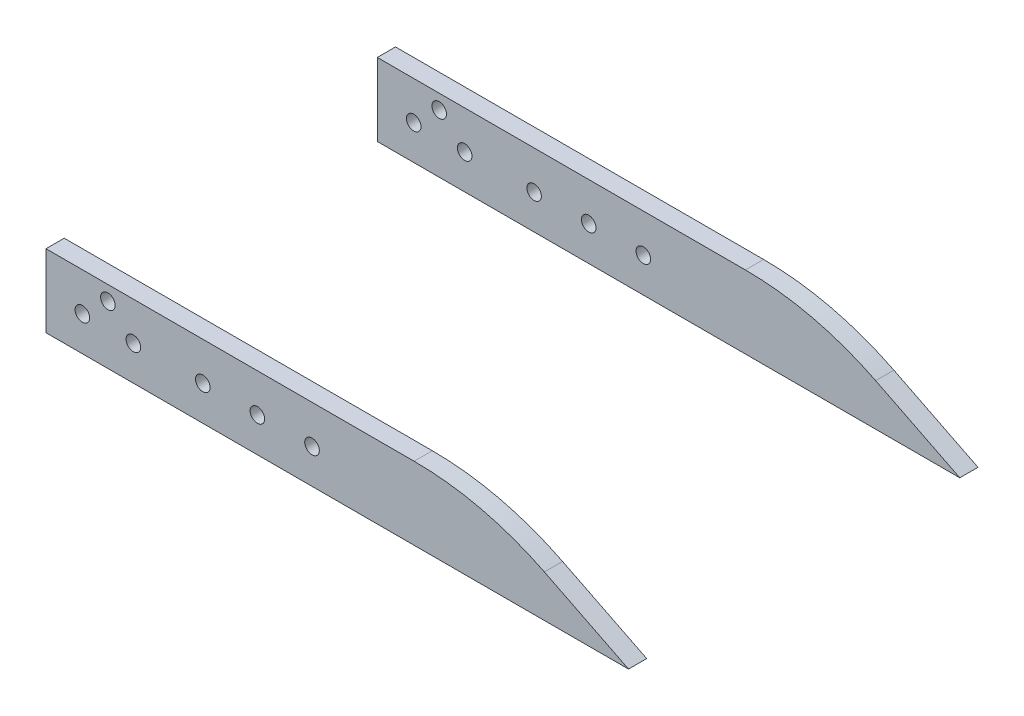
from build123d import *

# Parameters (mm, degrees)
BOSS_EXTRUDE1_START     = 91
BOSS_EXTRUDE1_DEPTH     = 5
BOSS_EXTRUDE2_DEPTH     = 5
CUT_EXTRUDE1_DEPTH      = 186.151289491
CUT_EXTRUDE1_DEPTH_BACK = 186.151289491
SKETCH3_R               = 2


with BuildPart() as part:
    # Sketch2 → Boss-Extrude1 (new body)
    with BuildSketch(Plane.XY.offset(BOSS_EXTRUDE1_START)):
        with BuildLine():
            Line((0, 0), (0, -20))
            Line((0, -20), (160, -20))
            Line((160, -20), (136.89164944, -8.44582472))
            ThreePointArc((136.89164944, -8.44582472), (119.494795444, -2.140080843), (101.1145618, 0))
            Line((101.1145618, 0), (0, 0))
        make_face()
    extrude(amount=BOSS_EXTRUDE1_DEPTH)


with BuildPart() as body_2:
    # Sketch2<2> → Boss-Extrude2 (new body)
    with BuildSketch(Plane.XY):
        with BuildLine():
            Line((0, 0), (0, -20))
            Line((0, -20), (160, -20))
            Line((160, -20), (136.89164944, -8.44582472))
            ThreePointArc((136.89164944, -8.44582472), (119.494795444, -2.140080843), (101.1145618, 0))
            Line((101.1145618, 0), (0, 0))
        make_face()
    extrude(amount=BOSS_EXTRUDE2_DEPTH)


with BuildPart() as cut_extrude1_tool:
    # Sketch3 → Cut-Extrude1 (new, two sides: drawn at the far end of the back side and taken through both)
    with BuildSketch(Plane.XY.offset(5).offset(-CUT_EXTRUDE1_DEPTH_BACK)):
        with Locations((10, -10.5)):
            Circle(SKETCH3_R)
        with Locations((17, -4)):
            Circle(SKETCH3_R)
        with Locations((24, -10.5)):
            Circle(SKETCH3_R)
        with Locations((43.06859969, -10.5)):
            Circle(SKETCH3_R)
        with Locations((58.06859969, -10.5)):
            Circle(SKETCH3_R)
        with Locations((73.06859969, -10.5)):
            Circle(SKETCH3_R)
    extrude(amount=CUT_EXTRUDE1_DEPTH + CUT_EXTRUDE1_DEPTH_BACK)


with BuildPart() as part_1:
    add(part.part)

    # Cut-Extrude1: cut by cut_extrude1_tool
    add(cut_extrude1_tool.part, mode=Mode.SUBTRACT)


with BuildPart() as body_2_1:
    add(body_2.part)

    # Cut-Extrude1: cut by cut_extrude1_tool
    add(cut_extrude1_tool.part, mode=Mode.SUBTRACT)


solid = Compound([part_1.part, body_2_1.part])
